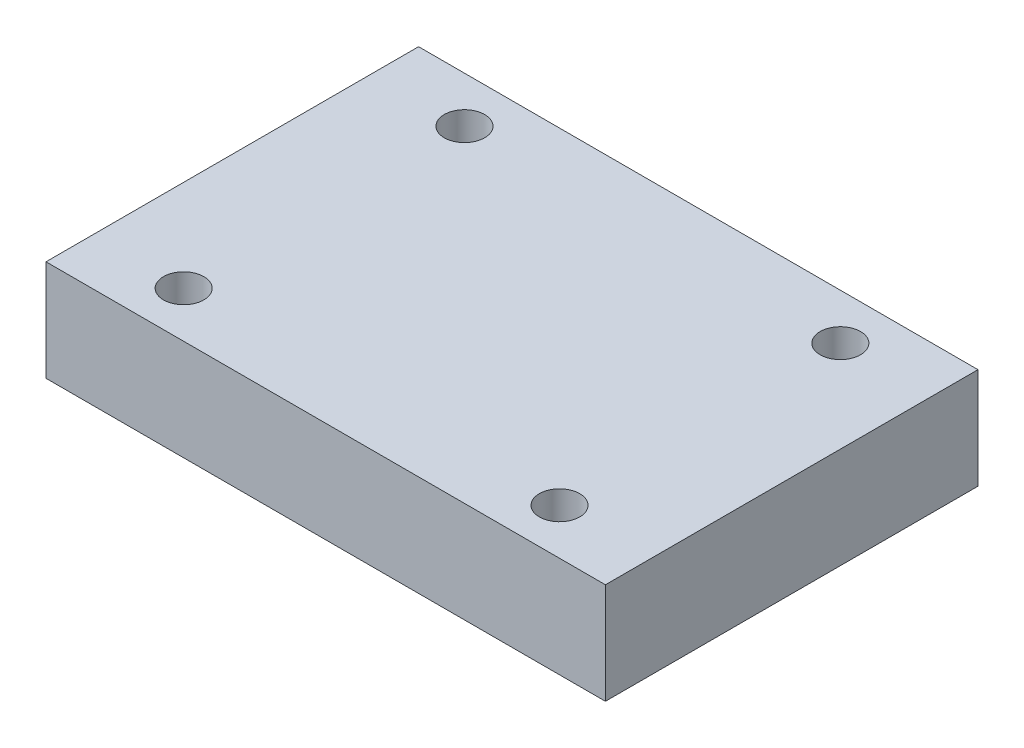
from build123d import *

# Parameters (mm, degrees)
SKETCH1_W           = 30.48
SKETCH1_H           = 20.3
SKETCH1_R           = 1.1
BOSS_EXTRUDE1_DEPTH = 5.5


with BuildPart() as part:
    # Sketch1 → Boss-Extrude1 (new body)
    with BuildSketch(Plane(origin=(0, 0, 0), x_dir=(1, 0, 0), z_dir=(0, 1, 0))):
        with Locations((15.24, 10.15)):
            Rectangle(SKETCH1_W, SKETCH1_H)
        with Locations(Location((5, 17.8, 0), (0, 0, 270))):
            Circle(SKETCH1_R, mode=Mode.SUBTRACT)
        with Locations(Location((25.48, 17.8, 0), (0, 0, 270))):
            Circle(SKETCH1_R, mode=Mode.SUBTRACT)
        with Locations(Location((25.48, 2.5, 0), (0, 0, 270))):
            Circle(SKETCH1_R, mode=Mode.SUBTRACT)
        with Locations(Location((5, 2.5, 0), (0, 0, 270))):
            Circle(SKETCH1_R, mode=Mode.SUBTRACT)
    extrude(amount=BOSS_EXTRUDE1_DEPTH)


solid = part.part
